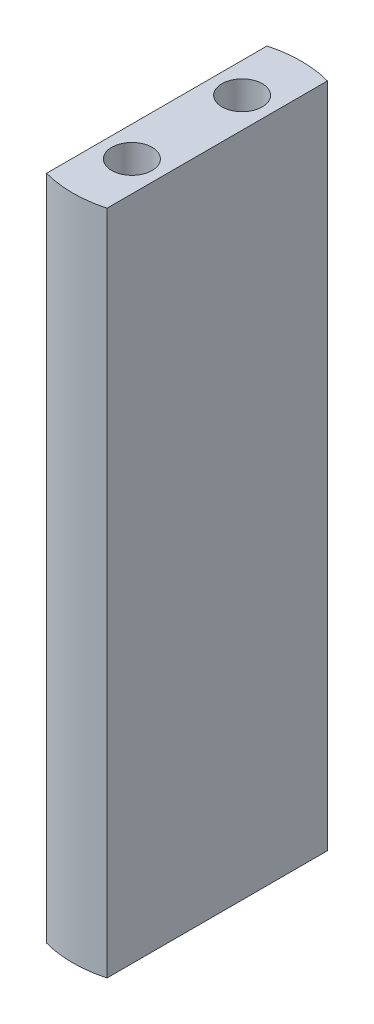
from build123d import *

# Parameters (mm, degrees)
SKETCH2_R           = 6.35
BOSS_EXTRUDE1_DEPTH = 210


with BuildPart() as part:
    # Sketch2 → Boss-Extrude1 (new body)
    # profile 1 of 2: a face of its own
    with BuildSketch(Plane(origin=(0, 0, 0), x_dir=(1, 0, 0), z_dir=(0, 1, 0))):
        with BuildLine():
            Line((9.525, -34.717061728), (9.525, 0))
            Line((9.525, 0), (-9.525, 0))
            Line((-9.525, 0), (-9.525, -34.717061728))
            ThreePointArc((-9.525, -34.717061728), (0, -36), (9.525, -34.717061728))
        make_face()
        with Locations(Location((0, -17.358530864, 0), (0, 0, 270))):
            Circle(SKETCH2_R, mode=Mode.SUBTRACT)
    # profile 2 of 2: a face of its own
    with BuildSketch(Plane(origin=(0, 0, 0), x_dir=(1, 0, 0), z_dir=(0, 1, 0))):
        with BuildLine():
            Line((-9.525, 0), (9.525, 0))
            Line((9.525, 0), (9.525, 34.717061728))
            ThreePointArc((9.525, 34.717061728), (0, 36), (-9.525, 34.717061728))
            Line((-9.525, 34.717061728), (-9.525, 0))
        make_face()
        with Locations(Location((0, 17.358530864, 0), (0, 0, 270))):
            Circle(SKETCH2_R, mode=Mode.SUBTRACT)
    extrude(amount=BOSS_EXTRUDE1_DEPTH)


solid = part.part
